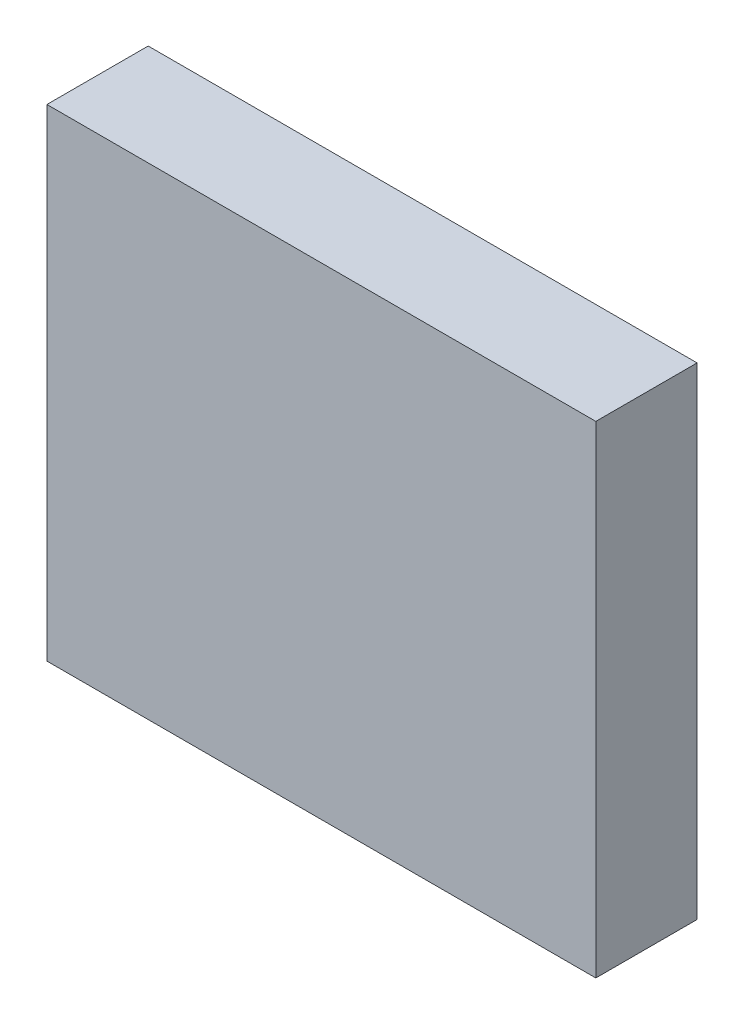
from build123d import *

# Parameters (mm, degrees)
ESQUISSE1_W        = 68.834
ESQUISSE1_H        = 60.452
BOSS_EXTRU_1_DEPTH = 12.7


with BuildPart() as part:
    # Esquisse1 → Boss.-Extru.1 (new body)
    with BuildSketch(Plane.XY):
        Rectangle(ESQUISSE1_W, ESQUISSE1_H)
    extrude(amount=BOSS_EXTRU_1_DEPTH)


solid = part.part
